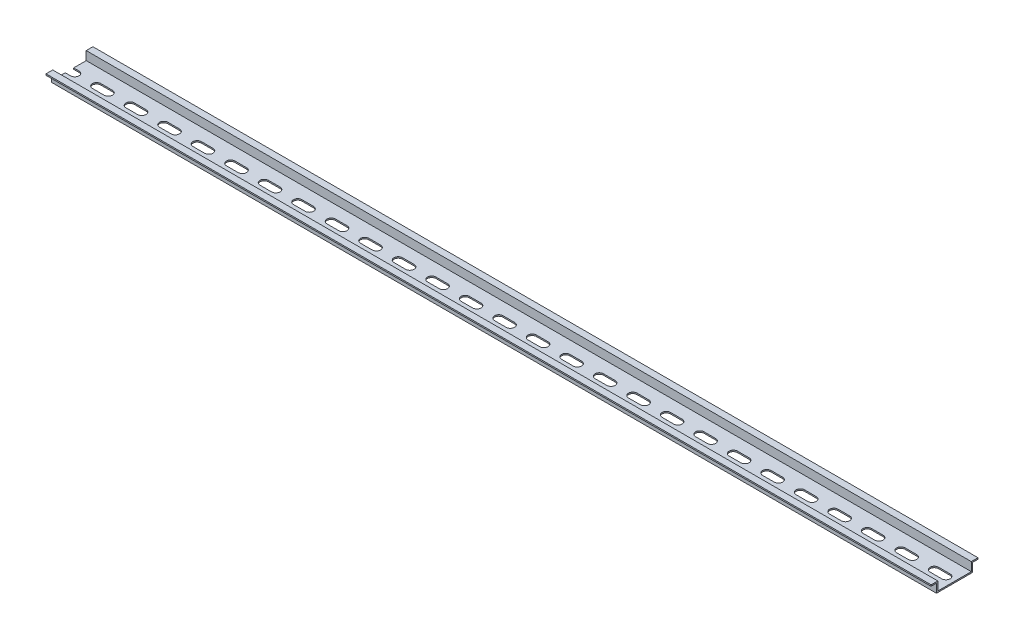
from build123d import *

# Parameters (mm, degrees)
SKETCH1_W               = 1000
SKETCH1_H               = 7.5
BOSS_EXTRUDE1_DEPTH     = 17.5
SKETCH2_W               = 1000
SKETCH2_H               = 25
CUT_EXTRUDE1_DEPTH      = 6.5
CUT_EXTRUDE2_DEPTH      = 1001.181233577
CUT_EXTRUDE2_DEPTH_BACK = 1001.181233577
SKETCH4_W               = 4
SKETCH4_H               = 6.5
CUT_EXTRUDE3_DEPTH      = 501.348378632
SKETCH6_W               = 35
SKETCH6_H               = 7.5
CUT_EXTRUDE4_DEPTH      = 339.6


with BuildPart() as part:
    # Sketch1 → Boss-Extrude1 (new, symmetric)
    with BuildSketch(Plane.XY):
        with Locations((0, 3.75)):
            Rectangle(SKETCH1_W, SKETCH1_H)
    extrude(amount=BOSS_EXTRUDE1_DEPTH, both=True)

    # Sketch2 → Cut-Extrude1 (cut)
    with BuildSketch(Plane(origin=(0, 7.5, 0), x_dir=(1, 0, 0), z_dir=(0, 1, 0))):
        Rectangle(SKETCH2_W, SKETCH2_H)
    extrude(amount=-CUT_EXTRUDE1_DEPTH, mode=Mode.SUBTRACT)

    # Sketch4 → Cut-Extrude2 (cut, two sides: drawn at the far end of the back side and taken through both)
    with BuildSketch(Plane(origin=(500, 0, 0), x_dir=(0, 0, -1), z_dir=(1, 0, 0)).offset(-CUT_EXTRUDE2_DEPTH_BACK)):
        with Locations((-15.5, 3.25)):
            Rectangle(SKETCH4_W, SKETCH4_H)
        with Locations((15.5, 3.25)):
            Rectangle(SKETCH4_W, SKETCH4_H)
    extrude(amount=CUT_EXTRUDE2_DEPTH + CUT_EXTRUDE2_DEPTH_BACK, mode=Mode.SUBTRACT)

    # Sketch5 → Cut-Extrude3 (cut, through all)
    with BuildSketch(Plane(origin=(0, 1, 0), x_dir=(1, 0, 0), z_dir=(0, 1, 0))):
        with BuildLine():
            Line((-504.69, 3.16), (-496.01, 3.16))
            ThreePointArc((-496.01, 3.16), (-492.85, 0), (-496.01, -3.16))
            Line((-496.01, -3.16), (-504.69, -3.16))
            ThreePointArc((-504.69, -3.16), (-507.85, 0), (-504.69, 3.16))
        make_face()
        with BuildLine():
            Line((-479.69, 3.16), (-471.01, 3.16))
            ThreePointArc((-471.01, 3.16), (-467.85, 0), (-471.01, -3.16))
            Line((-471.01, -3.16), (-479.69, -3.16))
            ThreePointArc((-479.69, -3.16), (-482.85, 0), (-479.69, 3.16))
        make_face()
        with BuildLine():
            Line((-454.69, 3.16), (-446.01, 3.16))
            ThreePointArc((-446.01, 3.16), (-442.85, 0), (-446.01, -3.16))
            Line((-446.01, -3.16), (-454.69, -3.16))
            ThreePointArc((-454.69, -3.16), (-457.85, 0), (-454.69, 3.16))
        make_face()
        with BuildLine():
            Line((-429.69, 3.16), (-421.01, 3.16))
            ThreePointArc((-421.01, 3.16), (-417.85, 0), (-421.01, -3.16))
            Line((-421.01, -3.16), (-429.69, -3.16))
            ThreePointArc((-429.69, -3.16), (-432.85, 0), (-429.69, 3.16))
        make_face()
        with BuildLine():
            Line((-404.69, 3.16), (-396.01, 3.16))
            ThreePointArc((-396.01, 3.16), (-392.85, 0), (-396.01, -3.16))
            Line((-396.01, -3.16), (-404.69, -3.16))
            ThreePointArc((-404.69, -3.16), (-407.85, 0), (-404.69, 3.16))
        make_face()
        with BuildLine():
            Line((-379.69, 3.16), (-371.01, 3.16))
            ThreePointArc((-371.01, 3.16), (-367.85, 0), (-371.01, -3.16))
            Line((-371.01, -3.16), (-379.69, -3.16))
            ThreePointArc((-379.69, -3.16), (-382.85, 0), (-379.69, 3.16))
        make_face()
        with BuildLine():
            Line((-354.69, 3.16), (-346.01, 3.16))
            ThreePointArc((-346.01, 3.16), (-342.85, 0), (-346.01, -3.16))
            Line((-346.01, -3.16), (-354.69, -3.16))
            ThreePointArc((-354.69, -3.16), (-357.85, 0), (-354.69, 3.16))
        make_face()
        with BuildLine():
            Line((-329.69, 3.16), (-321.01, 3.16))
            ThreePointArc((-321.01, 3.16), (-317.85, 0), (-321.01, -3.16))
            Line((-321.01, -3.16), (-329.69, -3.16))
            ThreePointArc((-329.69, -3.16), (-332.85, 0), (-329.69, 3.16))
        make_face()
        with BuildLine():
            Line((-304.69, 3.16), (-296.01, 3.16))
            ThreePointArc((-296.01, 3.16), (-292.85, 0), (-296.01, -3.16))
            Line((-296.01, -3.16), (-304.69, -3.16))
            ThreePointArc((-304.69, -3.16), (-307.85, 0), (-304.69, 3.16))
        make_face()
        with BuildLine():
            Line((-279.69, 3.16), (-271.01, 3.16))
            ThreePointArc((-271.01, 3.16), (-267.85, 0), (-271.01, -3.16))
            Line((-271.01, -3.16), (-279.69, -3.16))
            ThreePointArc((-279.69, -3.16), (-282.85, 0), (-279.69, 3.16))
        make_face()
        with BuildLine():
            Line((-254.69, 3.16), (-246.01, 3.16))
            ThreePointArc((-246.01, 3.16), (-242.85, 0), (-246.01, -3.16))
            Line((-246.01, -3.16), (-254.69, -3.16))
            ThreePointArc((-254.69, -3.16), (-257.85, 0), (-254.69, 3.16))
        make_face()
        with BuildLine():
            Line((-229.69, 3.16), (-221.01, 3.16))
            ThreePointArc((-221.01, 3.16), (-217.85, 0), (-221.01, -3.16))
            Line((-221.01, -3.16), (-229.69, -3.16))
            ThreePointArc((-229.69, -3.16), (-232.85, 0), (-229.69, 3.16))
        make_face()
        with BuildLine():
            Line((-204.69, 3.16), (-196.01, 3.16))
            ThreePointArc((-196.01, 3.16), (-192.85, 0), (-196.01, -3.16))
            Line((-196.01, -3.16), (-204.69, -3.16))
            ThreePointArc((-204.69, -3.16), (-207.85, 0), (-204.69, 3.16))
        make_face()
        with BuildLine():
            Line((-179.69, 3.16), (-171.01, 3.16))
            ThreePointArc((-171.01, 3.16), (-167.85, 0), (-171.01, -3.16))
            Line((-171.01, -3.16), (-179.69, -3.16))
            ThreePointArc((-179.69, -3.16), (-182.85, 0), (-179.69, 3.16))
        make_face()
        with BuildLine():
            Line((-154.69, 3.16), (-146.01, 3.16))
            ThreePointArc((-146.01, 3.16), (-142.85, 0), (-146.01, -3.16))
            Line((-146.01, -3.16), (-154.69, -3.16))
            ThreePointArc((-154.69, -3.16), (-157.85, 0), (-154.69, 3.16))
        make_face()
        with BuildLine():
            Line((-129.69, 3.16), (-121.01, 3.16))
            ThreePointArc((-121.01, 3.16), (-117.85, 0), (-121.01, -3.16))
            Line((-121.01, -3.16), (-129.69, -3.16))
            ThreePointArc((-129.69, -3.16), (-132.85, 0), (-129.69, 3.16))
        make_face()
        with BuildLine():
            Line((-104.69, 3.16), (-96.01, 3.16))
            ThreePointArc((-96.01, 3.16), (-92.85, 0), (-96.01, -3.16))
            Line((-96.01, -3.16), (-104.69, -3.16))
            ThreePointArc((-104.69, -3.16), (-107.85, 0), (-104.69, 3.16))
        make_face()
        with BuildLine():
            Line((-79.69, 3.16), (-71.01, 3.16))
            ThreePointArc((-71.01, 3.16), (-67.85, 0), (-71.01, -3.16))
            Line((-71.01, -3.16), (-79.69, -3.16))
            ThreePointArc((-79.69, -3.16), (-82.85, 0), (-79.69, 3.16))
        make_face()
        with BuildLine():
            Line((-54.69, 3.16), (-46.01, 3.16))
            ThreePointArc((-46.01, 3.16), (-42.85, 0), (-46.01, -3.16))
            Line((-46.01, -3.16), (-54.69, -3.16))
            ThreePointArc((-54.69, -3.16), (-57.85, 0), (-54.69, 3.16))
        make_face()
        with BuildLine():
            Line((-29.69, 3.16), (-21.01, 3.16))
            ThreePointArc((-21.01, 3.16), (-17.85, 0), (-21.01, -3.16))
            Line((-21.01, -3.16), (-29.69, -3.16))
            ThreePointArc((-29.69, -3.16), (-32.85, 0), (-29.69, 3.16))
        make_face()
        with BuildLine():
            Line((-4.69, 3.16), (3.99, 3.16))
            ThreePointArc((3.99, 3.16), (7.15, 0), (3.99, -3.16))
            Line((3.99, -3.16), (-4.69, -3.16))
            ThreePointArc((-4.69, -3.16), (-7.85, 0), (-4.69, 3.16))
        make_face()
        with BuildLine():
            Line((20.31, 3.16), (28.99, 3.16))
            ThreePointArc((28.99, 3.16), (32.15, 0), (28.99, -3.16))
            Line((28.99, -3.16), (20.31, -3.16))
            ThreePointArc((20.31, -3.16), (17.15, 0), (20.31, 3.16))
        make_face()
        with BuildLine():
            Line((45.31, 3.16), (53.99, 3.16))
            ThreePointArc((53.99, 3.16), (57.15, 0), (53.99, -3.16))
            Line((53.99, -3.16), (45.31, -3.16))
            ThreePointArc((45.31, -3.16), (42.15, 0), (45.31, 3.16))
        make_face()
        with BuildLine():
            Line((70.31, 3.16), (78.99, 3.16))
            ThreePointArc((78.99, 3.16), (82.15, 0), (78.99, -3.16))
            Line((78.99, -3.16), (70.31, -3.16))
            ThreePointArc((70.31, -3.16), (67.15, 0), (70.31, 3.16))
        make_face()
        with BuildLine():
            Line((95.31, 3.16), (103.99, 3.16))
            ThreePointArc((103.99, 3.16), (107.15, 0), (103.99, -3.16))
            Line((103.99, -3.16), (95.31, -3.16))
            ThreePointArc((95.31, -3.16), (92.15, 0), (95.31, 3.16))
        make_face()
        with BuildLine():
            Line((120.31, 3.16), (128.99, 3.16))
            ThreePointArc((128.99, 3.16), (132.15, 0), (128.99, -3.16))
            Line((128.99, -3.16), (120.31, -3.16))
            ThreePointArc((120.31, -3.16), (117.15, 0), (120.31, 3.16))
        make_face()
        with BuildLine():
            Line((145.31, 3.16), (153.99, 3.16))
            ThreePointArc((153.99, 3.16), (157.15, 0), (153.99, -3.16))
            Line((153.99, -3.16), (145.31, -3.16))
            ThreePointArc((145.31, -3.16), (142.15, 0), (145.31, 3.16))
        make_face()
        with BuildLine():
            Line((170.31, 3.16), (178.99, 3.16))
            ThreePointArc((178.99, 3.16), (182.15, 0), (178.99, -3.16))
            Line((178.99, -3.16), (170.31, -3.16))
            ThreePointArc((170.31, -3.16), (167.15, 0), (170.31, 3.16))
        make_face()
        with BuildLine():
            Line((195.31, 3.16), (203.99, 3.16))
            ThreePointArc((203.99, 3.16), (207.15, 0), (203.99, -3.16))
            Line((203.99, -3.16), (195.31, -3.16))
            ThreePointArc((195.31, -3.16), (192.15, 0), (195.31, 3.16))
        make_face()
        with BuildLine():
            Line((220.31, 3.16), (228.99, 3.16))
            ThreePointArc((228.99, 3.16), (232.15, 0), (228.99, -3.16))
            Line((228.99, -3.16), (220.31, -3.16))
            ThreePointArc((220.31, -3.16), (217.15, 0), (220.31, 3.16))
        make_face()
        with BuildLine():
            Line((245.31, 3.16), (253.99, 3.16))
            ThreePointArc((253.99, 3.16), (257.15, 0), (253.99, -3.16))
            Line((253.99, -3.16), (245.31, -3.16))
            ThreePointArc((245.31, -3.16), (242.15, 0), (245.31, 3.16))
        make_face()
        with BuildLine():
            Line((270.31, 3.16), (278.99, 3.16))
            ThreePointArc((278.99, 3.16), (282.15, 0), (278.99, -3.16))
            Line((278.99, -3.16), (270.31, -3.16))
            ThreePointArc((270.31, -3.16), (267.15, 0), (270.31, 3.16))
        make_face()
        with BuildLine():
            Line((295.31, 3.16), (303.99, 3.16))
            ThreePointArc((303.99, 3.16), (307.15, 0), (303.99, -3.16))
            Line((303.99, -3.16), (295.31, -3.16))
            ThreePointArc((295.31, -3.16), (292.15, 0), (295.31, 3.16))
        make_face()
        with BuildLine():
            Line((320.31, 3.16), (328.99, 3.16))
            ThreePointArc((328.99, 3.16), (332.15, 0), (328.99, -3.16))
            Line((328.99, -3.16), (320.31, -3.16))
            ThreePointArc((320.31, -3.16), (317.15, 0), (320.31, 3.16))
        make_face()
        with BuildLine():
            Line((345.31, 3.16), (353.99, 3.16))
            ThreePointArc((353.99, 3.16), (357.15, 0), (353.99, -3.16))
            Line((353.99, -3.16), (345.31, -3.16))
            ThreePointArc((345.31, -3.16), (342.15, 0), (345.31, 3.16))
        make_face()
        with BuildLine():
            Line((370.31, 3.16), (378.99, 3.16))
            ThreePointArc((378.99, 3.16), (382.15, 0), (378.99, -3.16))
            Line((378.99, -3.16), (370.31, -3.16))
            ThreePointArc((370.31, -3.16), (367.15, 0), (370.31, 3.16))
        make_face()
        with BuildLine():
            Line((395.31, 3.16), (403.99, 3.16))
            ThreePointArc((403.99, 3.16), (407.15, 0), (403.99, -3.16))
            Line((403.99, -3.16), (395.31, -3.16))
            ThreePointArc((395.31, -3.16), (392.15, 0), (395.31, 3.16))
        make_face()
        with BuildLine():
            Line((420.31, 3.16), (428.99, 3.16))
            ThreePointArc((428.99, 3.16), (432.15, 0), (428.99, -3.16))
            Line((428.99, -3.16), (420.31, -3.16))
            ThreePointArc((420.31, -3.16), (417.15, 0), (420.31, 3.16))
        make_face()
        with BuildLine():
            Line((445.31, 3.16), (453.99, 3.16))
            ThreePointArc((453.99, 3.16), (457.15, 0), (453.99, -3.16))
            Line((453.99, -3.16), (445.31, -3.16))
            ThreePointArc((445.31, -3.16), (442.15, 0), (445.31, 3.16))
        make_face()
        with BuildLine():
            Line((470.31, 3.16), (478.99, 3.16))
            ThreePointArc((478.99, 3.16), (482.15, 0), (478.99, -3.16))
            Line((478.99, -3.16), (470.31, -3.16))
            ThreePointArc((470.31, -3.16), (467.15, 0), (470.31, 3.16))
        make_face()
        with BuildLine():
            Line((495.31, 3.16), (503.99, 3.16))
            ThreePointArc((503.99, 3.16), (507.15, 0), (503.99, -3.16))
            Line((503.99, -3.16), (495.31, -3.16))
            ThreePointArc((495.31, -3.16), (492.15, 0), (495.31, 3.16))
        make_face()
    extrude(amount=-CUT_EXTRUDE3_DEPTH, mode=Mode.SUBTRACT)

    # Sketch6 → Cut-Extrude4 (cut)
    with BuildSketch(Plane(origin=(500, 0, 0), x_dir=(0, 0, -1), z_dir=(1, 0, 0))):
        with Locations((0, 3.75)):
            Rectangle(SKETCH6_W, SKETCH6_H)
    extrude(amount=-CUT_EXTRUDE4_DEPTH, mode=Mode.SUBTRACT)


solid = part.part
